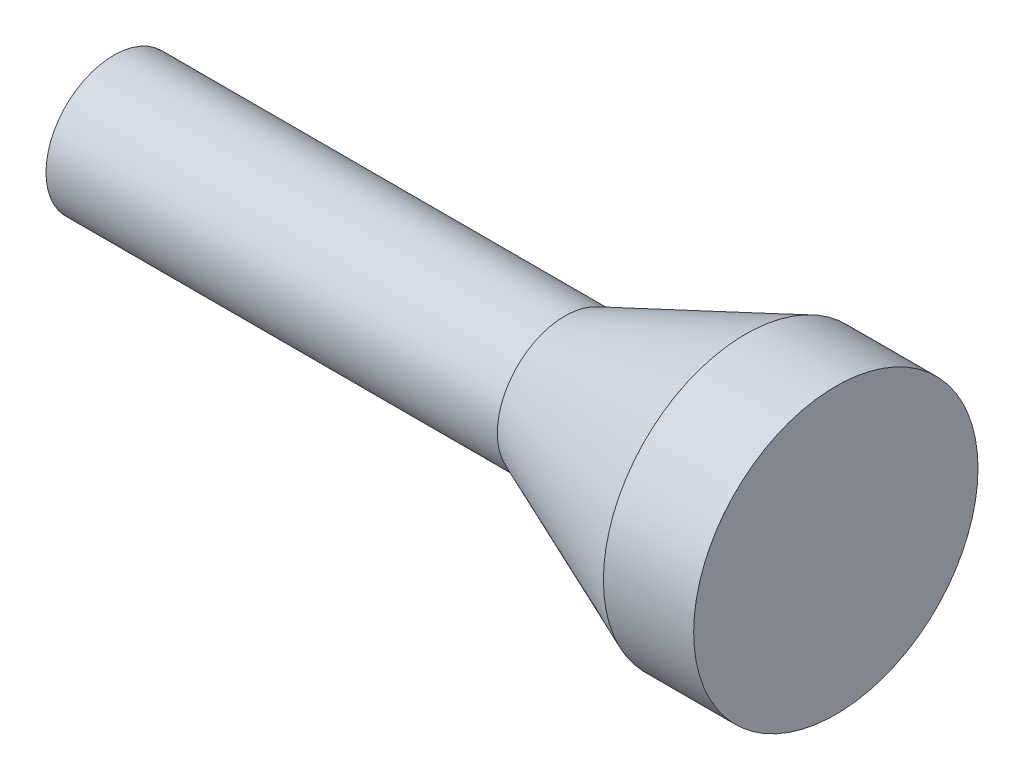
from build123d import *


with BuildPart() as part:
    # Sketch1 → Revolve1 (revolve)
    with BuildSketch(Plane.XY):
        Polygon((190.5, 0), (190.5, 80.01), (139.7, 80.01), (38.1, 38.1), (-215.9, 38.1), (-215.9, 0), align=None)
    revolve(axis=Axis((-88.99, 0, 0), (1, 0, 0)))


solid = part.part
